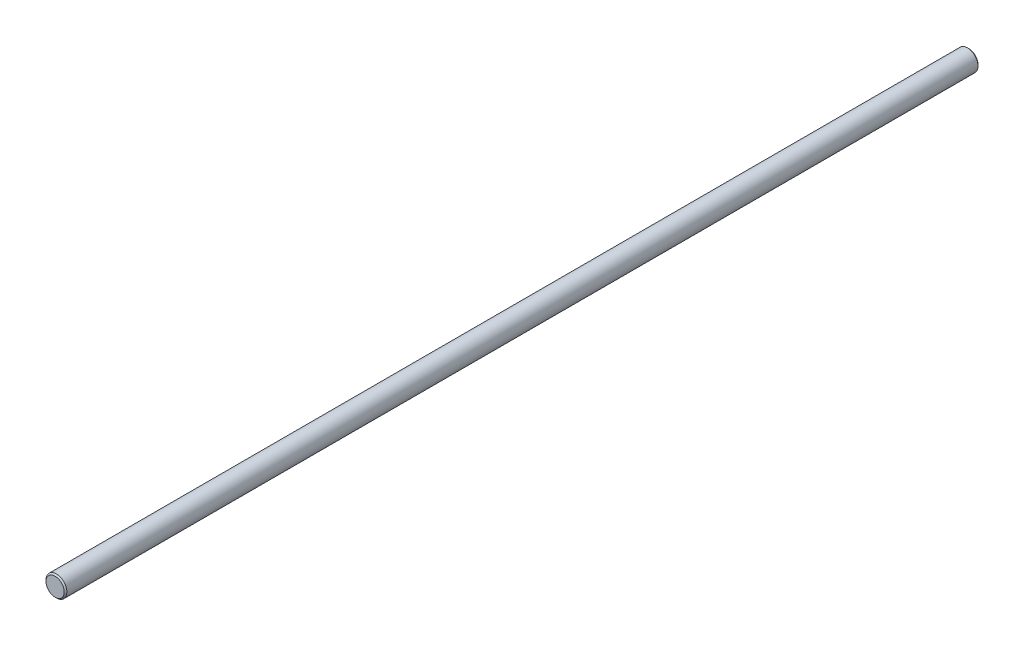
from build123d import *

# Parameters (mm, degrees)
SZKIC1_R                    = 4
DODANIE_WYCI_GNI_CIE1_DEPTH = 350
SFAZOWANIE1_SIZE            = 0.5


with BuildPart() as part:
    # Szkic1 → Dodanie-wyciągnięcie1 (new body)
    with BuildSketch(Plane.XY):
        Circle(SZKIC1_R)
    extrude(amount=DODANIE_WYCI_GNI_CIE1_DEPTH)

    # Sfazowanie1
    sfazowanie1_edges = [part.edges().sort_by_distance(p)[0] for p in [
        (-4, 0, 0),
        (-4, 0, 350),
    ]]
    chamfer(sfazowanie1_edges, length=SFAZOWANIE1_SIZE)


solid = part.part
